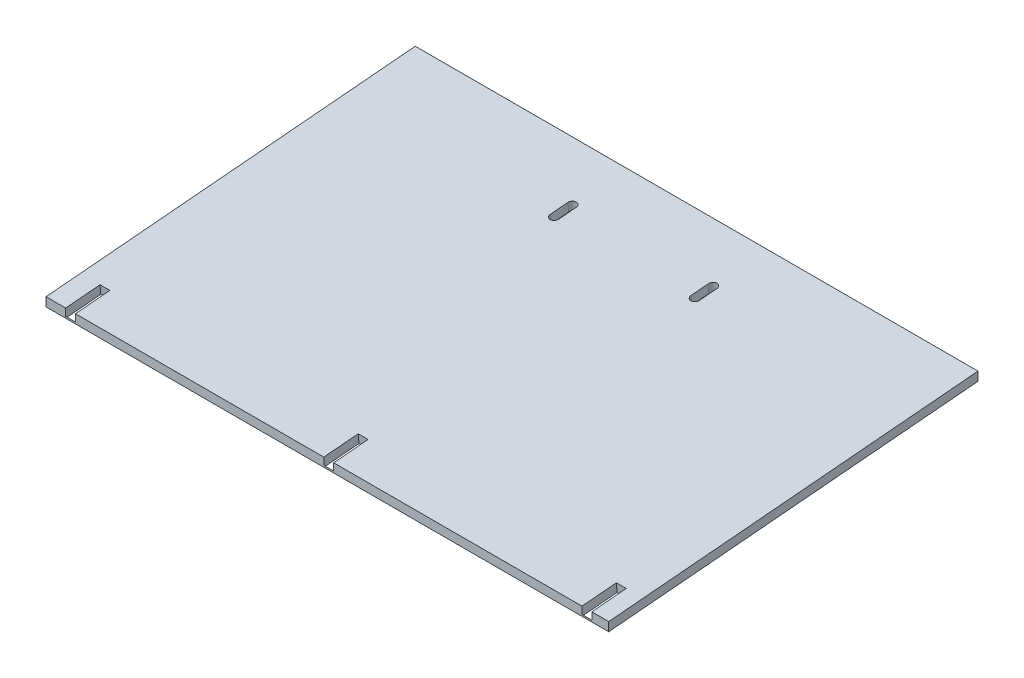
from build123d import *

# Parameters (mm, degrees)
BOSS_EXTRUDE1_DEPTH = 203.2
CUT_EXTRUDE1_DEPTH  = 316.247758015
CUT_EXTRUDE2_REACH  = 317.248
SKETCH3_W           = 3.556
SKETCH3_H           = 12.7


with BuildPart() as part:
    # Sketch1 → Boss-Extrude1 (new body)
    with BuildSketch(Plane(origin=(0, 0, 0), x_dir=(0, 0, -1), z_dir=(1, 0, 0))):
        Polygon((107.95, -4.33747573), (107.95, -7.524603714), (241.3, 4.142009567), (241.3, 7.329137551), align=None)
    extrude(amount=BOSS_EXTRUDE1_DEPTH)

    # Sketch2 → Cut-Extrude1 (cut, through all)
    with BuildSketch(Plane(origin=(0, -13.677188118, -1.196598909), x_dir=(1, 0, 0), z_dir=(0, 0.9961946980917459, 0.08715574274765497))):
        with BuildLine():
            Line((74.676, 221.335557077), (74.676, 214.985557077))
            ThreePointArc((74.676, 214.985557077), (76.2, 213.461557077), (77.724, 214.985557077))
            Line((77.724, 214.985557077), (77.724, 221.335557077))
            ThreePointArc((77.724, 221.335557077), (76.2, 222.859557077), (74.676, 221.335557077))
        make_face()
        with BuildLine():
            Line((128.524, 221.335557077), (128.524, 214.985557077))
            ThreePointArc((128.524, 214.985557077), (127, 213.461557077), (125.476, 214.985557077))
            Line((125.476, 214.985557077), (125.476, 221.335557077))
            ThreePointArc((125.476, 221.335557077), (127, 222.859557077), (128.524, 221.335557077))
        make_face()
    extrude(amount=-CUT_EXTRUDE1_DEPTH, mode=Mode.SUBTRACT)

    # Sketch3 → Cut-Extrude2 (cut, up to next)
    with BuildSketch(Plane(origin=(0, -13.677188118, -1.196598909), x_dir=(1, 0, 0), z_dir=(0, 0.9961946980917459, 0.08715574274765481)), mode=Mode.PRIVATE) as cut_extrude2_sk1:
        with Locations((8.870592235, 113.286692619)):
            Rectangle(SKETCH3_W, SKETCH3_H)
    cut_extrude2_tool1 = extrude(cut_extrude2_sk1.sketch, amount=-CUT_EXTRUDE2_REACH, mode=Mode.PRIVATE) & part.part
    # Sketch3 → Cut-Extrude2 (cut, up to next)
    with BuildSketch(Plane(origin=(0, -13.677188118, -1.196598909), x_dir=(1, 0, 0), z_dir=(0, 0.9961946980917459, 0.08715574274765481)), mode=Mode.PRIVATE) as cut_extrude2_sk2:
        with Locations((102.088592235, 113.286692619)):
            Rectangle(SKETCH3_W, SKETCH3_H)
    cut_extrude2_tool2 = extrude(cut_extrude2_sk2.sketch, amount=-CUT_EXTRUDE2_REACH, mode=Mode.PRIVATE) & part.part
    # Sketch3 → Cut-Extrude2 (cut, up to next)
    with BuildSketch(Plane(origin=(0, -13.677188118, -1.196598909), x_dir=(1, 0, 0), z_dir=(0, 0.9961946980917459, 0.08715574274765481)), mode=Mode.PRIVATE) as cut_extrude2_sk3:
        with Locations((195.306592235, 113.286692619)):
            Rectangle(SKETCH3_W, SKETCH3_H)
    cut_extrude2_tool3 = extrude(cut_extrude2_sk3.sketch, amount=-CUT_EXTRUDE2_REACH, mode=Mode.PRIVATE) & part.part
    add(cut_extrude2_tool1.solids().sort_by_distance((8.870592, -3.803602, -114.052201))[0], mode=Mode.SUBTRACT)
    add(cut_extrude2_tool2.solids().sort_by_distance((102.088592, -3.803602, -114.052201))[0], mode=Mode.SUBTRACT)
    add(cut_extrude2_tool3.solids().sort_by_distance((195.306592, -3.803602, -114.052201))[0], mode=Mode.SUBTRACT)


solid = part.part
